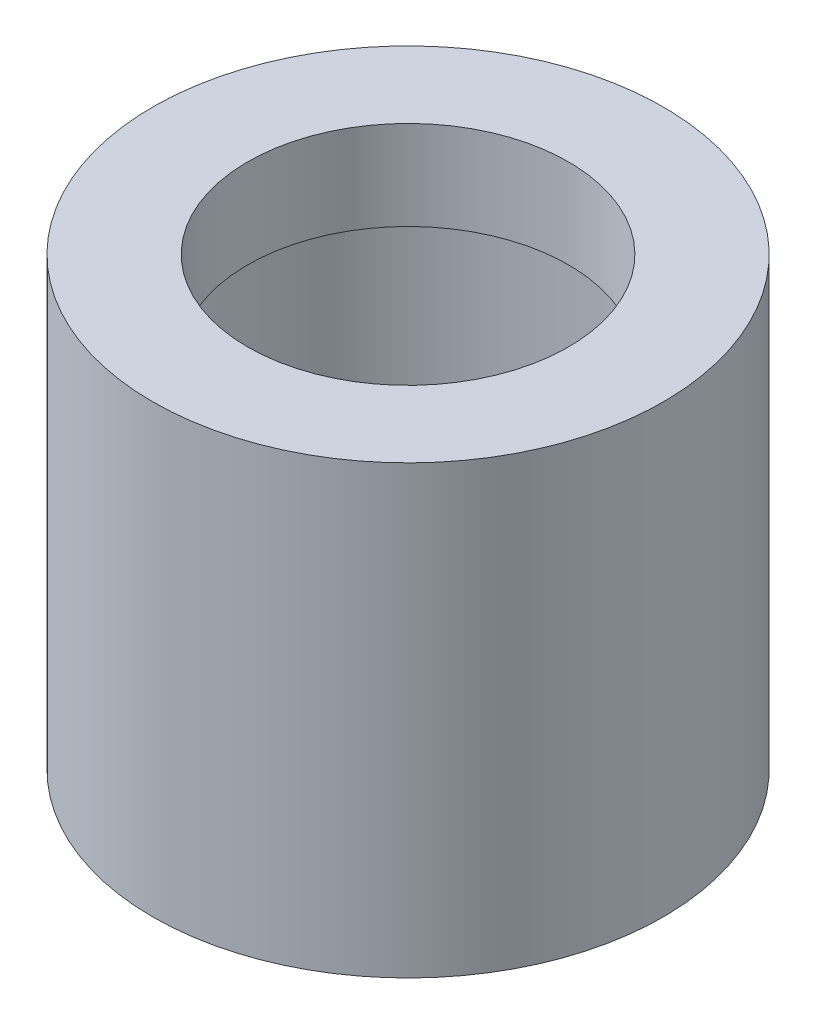
from build123d import *

# Parameters (mm, degrees)
SKETCH1_R           = 13.45
SKETCH1_R_2         = 10.9
BOSS_EXTRUDE1_DEPTH = 18.8
SKETCH3_R           = 13.45
SKETCH3_R_2         = 8.45
BOSS_EXTRUDE2_DEPTH = 4.7


with BuildPart() as part:
    # Sketch1 → Boss-Extrude1 (new body)
    with BuildSketch(Plane(origin=(0, 0, 0), x_dir=(1, 0, 0), z_dir=(0, 1, 0))):
        with Locations(Location((0, 0, 0), (0, 0, 270))):
            Circle(SKETCH1_R)
        with Locations(Location((0, 0, 0), (0, 0, 270))):
            Circle(SKETCH1_R_2, mode=Mode.SUBTRACT)
    extrude(amount=BOSS_EXTRUDE1_DEPTH)

    # Sketch3 → Boss-Extrude2 (add)
    with BuildSketch(Plane(origin=(0, 18.8, 0), x_dir=(1, 0, 0), z_dir=(0, 1, 0))):
        with Locations(Location((0, 0, 0), (0, 0, 270))):
            Circle(SKETCH3_R)
        with Locations(Location((0, 0, 0), (0, 0, 270))):
            Circle(SKETCH3_R_2, mode=Mode.SUBTRACT)
    extrude(amount=BOSS_EXTRUDE2_DEPTH)


solid = part.part
